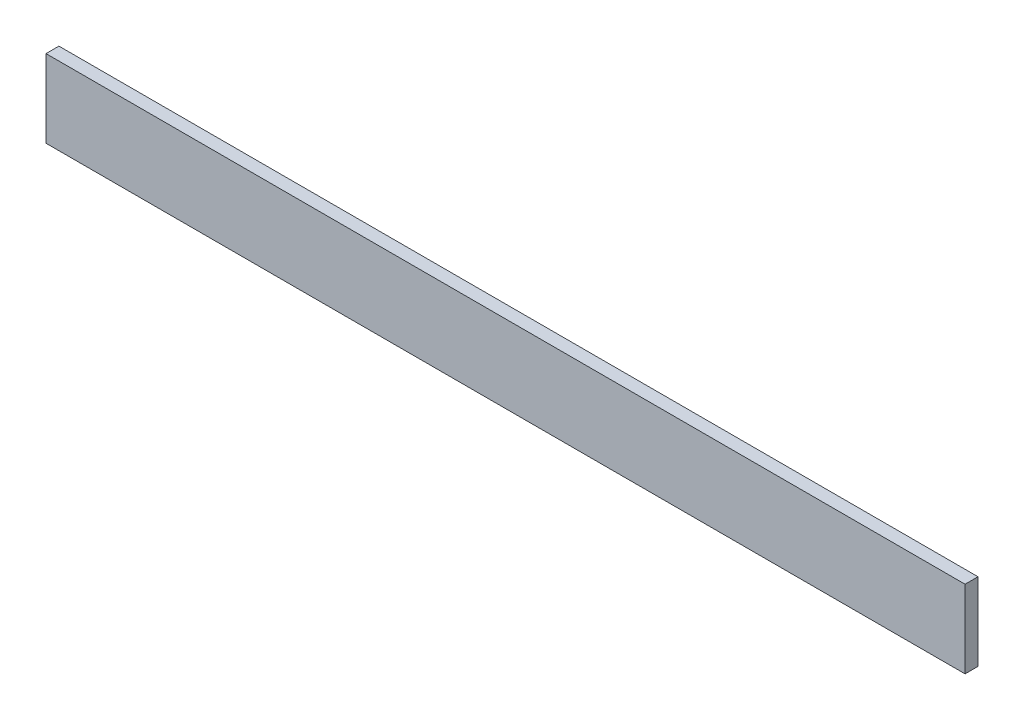
from build123d import *

# Parameters (mm, degrees)
SKETCH1_W           = 50.8
SKETCH1_H           = 304.8
BOSS_EXTRUDE1_DEPTH = 3606.8


with BuildPart() as part:
    # Sketch1 → Boss-Extrude1 (new body)
    with BuildSketch(Plane(origin=(0, 0, 0), x_dir=(0, 0, -1), z_dir=(1, 0, 0))):
        with Locations((25.4, 152.4)):
            Rectangle(SKETCH1_W, SKETCH1_H)
    extrude(amount=BOSS_EXTRUDE1_DEPTH)


solid = part.part
